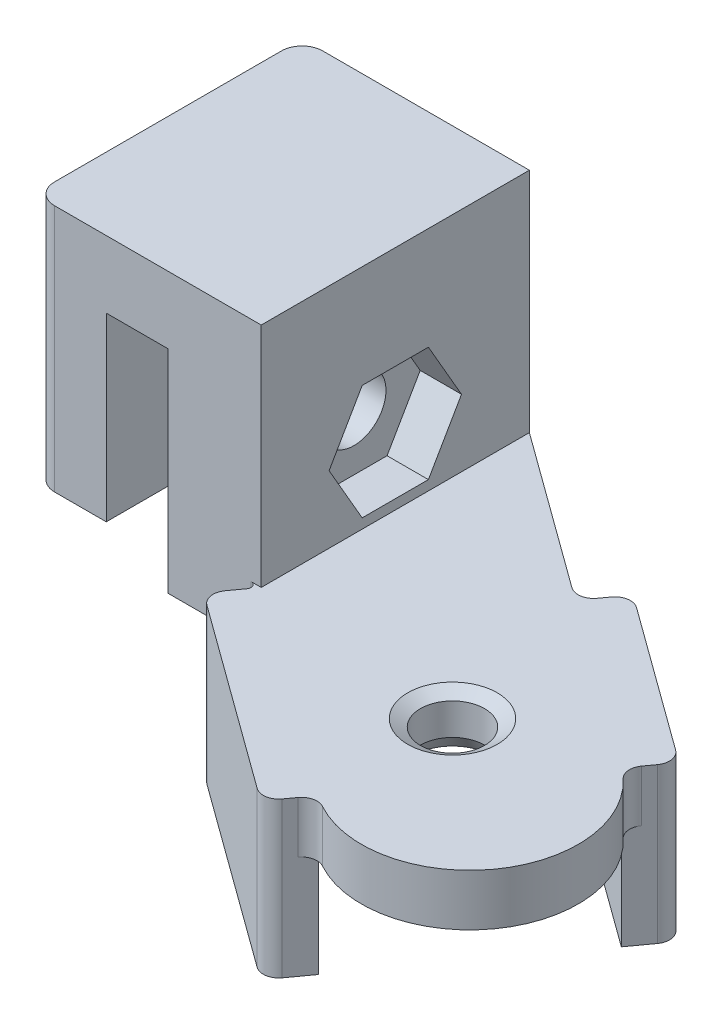
from build123d import *
from OCP.BRepFilletAPI import BRepFilletAPI_MakeChamfer

# Parameters (mm, degrees)
SKETCH_1_R             = 1.55
EXTRUDE_512_DEPTH      = 2.5
EXTRUDE_START          = 2.5
EXTRUDE_979_DEPTH      = 7.5
SKETCH_3_W             = 4.5
SKETCH_3_H             = 12.978713764
EXTRUDE_1_DEPTH        = 13.5
EXTRUDE_START_2        = -0.866441
EXTRUDE_2_DEPTH        = 12.978713764
SKETCH_5_R             = 1.55
CUT_EXTRUDE_1800_DEPTH = 36.225185951
CUT_EXTRUDE_START      = 9
SKETCH_5_3_R           = 1.55
CUT_EXTRUDE_1842_DEPTH = 2
CHAMFER_1_SIZE         = 0.615
CHAMFER_1_SIZE2        = 0.355070416
FILLET_5_R             = 0.75
FILLET_6_R             = 0.25
FILLET_8_R             = 1


with BuildPart() as part:
    # 草图1 → Extrude 512 (new body)
    with BuildSketch(Plane(origin=(0, 0, 0), x_dir=(1, 0, 0), z_dir=(0, 1, 0))):
        with BuildLine():
            Line((-10.1243866, 13.845154317), (6.15423406, 2.01804411))
            ThreePointArc((6.15423406, 2.01804411), (7.315700706, -5.315167685), (-0.017511089, -6.476634331))
            Line((-0.017511089, -6.476634331), (-10.1243866, 0.866440553))
            Line((-10.1243866, 0.866440553), (-10.1243866, 13.845154317))
        make_face()
        with Locations(Location((0, 0, 0), (0, 0, 270))):
            Circle(SKETCH_1_R, mode=Mode.SUBTRACT)
    extrude(amount=EXTRUDE_512_DEPTH)

    # 草图2 → Extrude 979 (add)
    with BuildSketch(Plane(origin=(0, 0, 0), x_dir=(1, 0, 0), z_dir=(0, 1, 0)).offset(EXTRUDE_START)):
        Polygon((-10.1243866, 0.866440553), (-0.017511089, -6.476634331), (-1.193081594, -8.09466832), (-11.299957105, -0.751593436), align=None)
        Polygon((7.329804565, 3.636078099), (-0.809505765, 9.549633202), (-1.98507627, 7.931599213), (6.15423406, 2.01804411), align=None)
    extrude(amount=-EXTRUDE_979_DEPTH)

    # 草图3 → 限位-1 (add)
    with BuildSketch(Plane(origin=(0, 0, 0), x_dir=(1, 0, 0), z_dir=(0, 1, 0))):
        with Locations((-12.3743866, 7.355797435)):
            Rectangle(SKETCH_3_W, SKETCH_3_H)
    extrude(amount=EXTRUDE_1_DEPTH)

    # 草图4 → 限位-2 (add)
    with BuildSketch(Plane.XY.offset(EXTRUDE_START_2)):
        Polygon((-14.6243866, 10.25), (-14.6243866, 13.5), (-21.1243866, 13.5), (-21.1243866, 1.5), (-17.6243866, 1.5), (-17.6243866, 10.25), align=None)
    extrude(amount=-EXTRUDE_2_DEPTH)

    # 草图5 → Cut-Extrude 1800 (cut, through all)
    with BuildSketch(Plane(origin=(-21.1243866, 0, 0), x_dir=(0, 0, -1), z_dir=(1, 0, 0))):
        with Locations(Location((7.355797435, 5.75, 0), (0, 0, 180))):
            Circle(SKETCH_5_R)
    extrude(amount=CUT_EXTRUDE_1800_DEPTH, mode=Mode.SUBTRACT)

    # 草图5<3> → Cut-Extrude 1842 (cut)
    with BuildSketch(Plane(origin=(-21.1243866, 0, 0), x_dir=(0, 0, -1), z_dir=(1, 0, 0)).offset(CUT_EXTRUDE_START)):
        Polygon((5.753650438, 2.975), (8.957944432, 2.975), (10.560091429, 5.75), (8.957944432, 8.525), (5.753650438, 8.525), (4.151503441, 5.75), align=None)
        with Locations(Location((7.355797435, 5.75, 0), (0, 0, 180))):
            Circle(SKETCH_5_3_R, mode=Mode.SUBTRACT)
    extrude(amount=CUT_EXTRUDE_1842_DEPTH, mode=Mode.SUBTRACT)

    # 倒角1: one chamfer whose edges measure the first distance from different faces: ONE call of the kernel's chamfer builder (chamfer() names one face for all edges)
    chamfer_1_edges_1 = [part.edges().sort_by_distance(p)[0] for p in [
        (0, 0, -1.55),
    ]]
    chamfer_1_side_1 = [part.faces().sort_by_distance(p)[0] for p in [
        (0, 1.25, -1.55),
    ]]
    chamfer_1_edges_2 = [part.edges().sort_by_distance(p)[0] for p in [
        (0, 2.5, -1.55),
    ]]
    chamfer_1_side_2 = [part.faces().sort_by_distance(p)[0] for p in [
        (-1.825655455, 2.5, -1.521026415),
    ]]
    chamfer_1_edges_3 = [part.edges().sort_by_distance(p)[0] for p in [
        (-21.1243866, 5.75, -8.905797435),
    ]]
    chamfer_1_side_3 = [part.faces().sort_by_distance(p)[0] for p in [
        (-19.3743866, 5.75, -8.905797435),
    ]]
    chamfer_1 = BRepFilletAPI_MakeChamfer(part.part.solid().wrapped)
    for e in chamfer_1_edges_1:
        chamfer_1.Add(CHAMFER_1_SIZE, CHAMFER_1_SIZE2, e.wrapped, chamfer_1_side_1[0].wrapped)  # the first distance lies on this face
    for e in chamfer_1_edges_2:
        chamfer_1.Add(CHAMFER_1_SIZE, CHAMFER_1_SIZE2, e.wrapped, chamfer_1_side_2[0].wrapped)  # the first distance lies on this face
    for e in chamfer_1_edges_3:
        chamfer_1.Add(CHAMFER_1_SIZE, CHAMFER_1_SIZE2, e.wrapped, chamfer_1_side_3[0].wrapped)  # the first distance lies on this face
    add(Compound.cast(chamfer_1.Shape()), mode=Mode.REPLACE)

    # 圆角5
    fillet_5_edges = [part.edges().sort_by_distance(p)[0] for p in [
        (-1.193081594, -1.25, 8.09466832),
        (-11.299957105, -1.25, 0.751593436),
        (-1.98507627, 1.25, -7.931599213),
        (-0.809505765, -1.25, -9.549633202),
        (7.329804565, -1.25, -3.636078099),
        (-0.017511089, 1.25, 6.476634331),
        (6.15423406, 1.25, -2.01804411),
    ]]
    fillet(fillet_5_edges, radius=FILLET_5_R)

    # 圆角6
    fillet_6_edges = [part.edges().sort_by_distance(p)[0] for p in [
        (-10.1243866, 1.25, -0.866440553),
    ]]
    fillet(fillet_6_edges, radius=FILLET_6_R)

    # 圆角8
    fillet_8_edges = [part.edges().sort_by_distance(p)[0] for p in [
        (-21.1243866, 7.5, -13.845154764),
        (-21.1243866, 7.5, -0.866441),
    ]]
    fillet(fillet_8_edges, radius=FILLET_8_R)


solid = part.part
